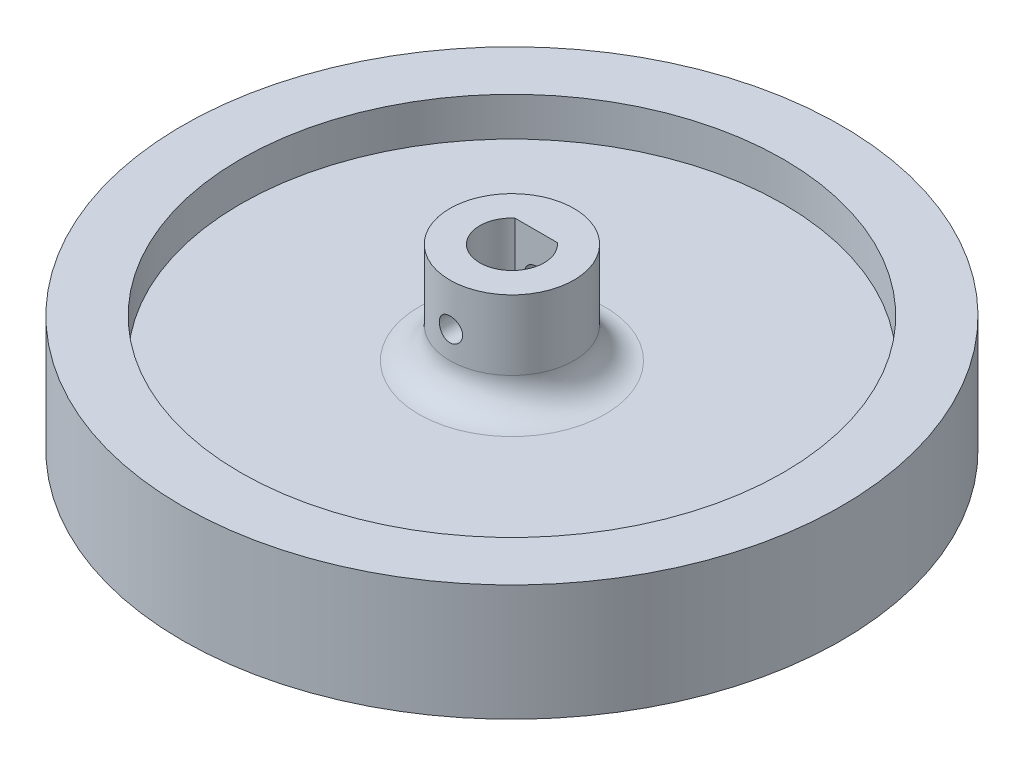
from build123d import *

# Parameters (mm, degrees)
SKETCH1_R           = 35
SKETCH1_R_2         = 4.175
BOSS_EXTRUDE1_DEPTH = 2.5
SKETCH1_3_R         = 42.5
SKETCH1_3_R_2       = 35
BOSS_EXTRUDE2_DEPTH = 7.5
SKETCH2_R           = 8
BOSS_EXTRUDE3_DEPTH = 13
FILLET1_R           = 4
SKETCH3_R           = 1.5
CUT_EXTRUDE1_DEPTH  = 12.5


with BuildPart() as part:
    # Sketch1 → Boss-Extrude1 (new, symmetric)
    with BuildSketch(Plane(origin=(0, 0, 0), x_dir=(1, 0, 0), z_dir=(0, 1, 0))):
        Circle(SKETCH1_R)
        Circle(SKETCH1_R_2, mode=Mode.SUBTRACT)
    extrude(amount=BOSS_EXTRUDE1_DEPTH, both=True)

    # Sketch1<3> → Boss-Extrude2 (add, symmetric)
    with BuildSketch(Plane(origin=(0, 0, 0), x_dir=(1, 0, 0), z_dir=(0, 1, 0))):
        Circle(SKETCH1_3_R)
        Circle(SKETCH1_3_R_2, mode=Mode.SUBTRACT)
    extrude(amount=BOSS_EXTRUDE2_DEPTH, both=True)

    # Sketch2 → Boss-Extrude3 (add)
    with BuildSketch(Plane(origin=(0, 2.5, 0), x_dir=(1, 0, 0), z_dir=(0, 1, 0))):
        Circle(SKETCH2_R)
        with BuildLine():
            Line((-2.744966985, 3.1125), (2.744966985, 3.1125))
            ThreePointArc((2.744966985, 3.1125), (0, -4.15), (-2.744966985, 3.1125))
        make_face(mode=Mode.SUBTRACT)
    extrude(amount=BOSS_EXTRUDE3_DEPTH)

    # Fillet1
    fillet1_edges = [part.edges().sort_by_distance(p)[0] for p in [
        (-8, 2.5, 0),
    ]]
    fillet(fillet1_edges, radius=FILLET1_R)

    # Sketch3 → Cut-Extrude1 (cut, symmetric)
    with BuildSketch(Plane.XY):
        with Locations((0, 10)):
            Circle(SKETCH3_R)
    extrude(amount=CUT_EXTRUDE1_DEPTH, both=True, mode=Mode.SUBTRACT)


solid = part.part
